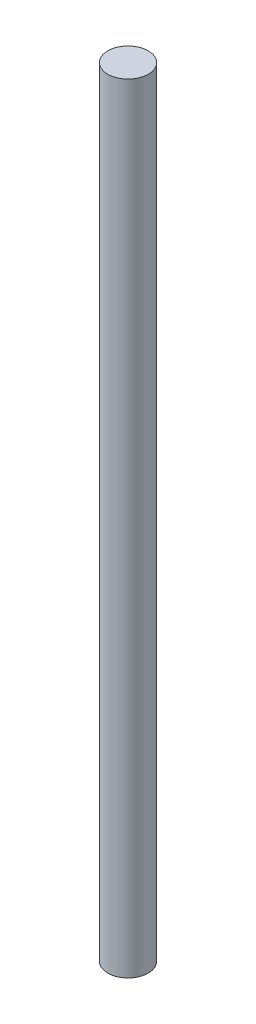
from build123d import *

# Parameters (mm, degrees)
SKETCH1_R           = 3.96875
BOSS_EXTRUDE1_DEPTH = 152.4


with BuildPart() as part:
    # Sketch1 → Boss-Extrude1 (new body)
    with BuildSketch(Plane(origin=(0, 0, 0), x_dir=(1, 0, 0), z_dir=(0, 1, 0))):
        with Locations(Location((0, 0, 0), (0, 0, 90))):
            Circle(SKETCH1_R)
    extrude(amount=BOSS_EXTRUDE1_DEPTH)


solid = part.part
